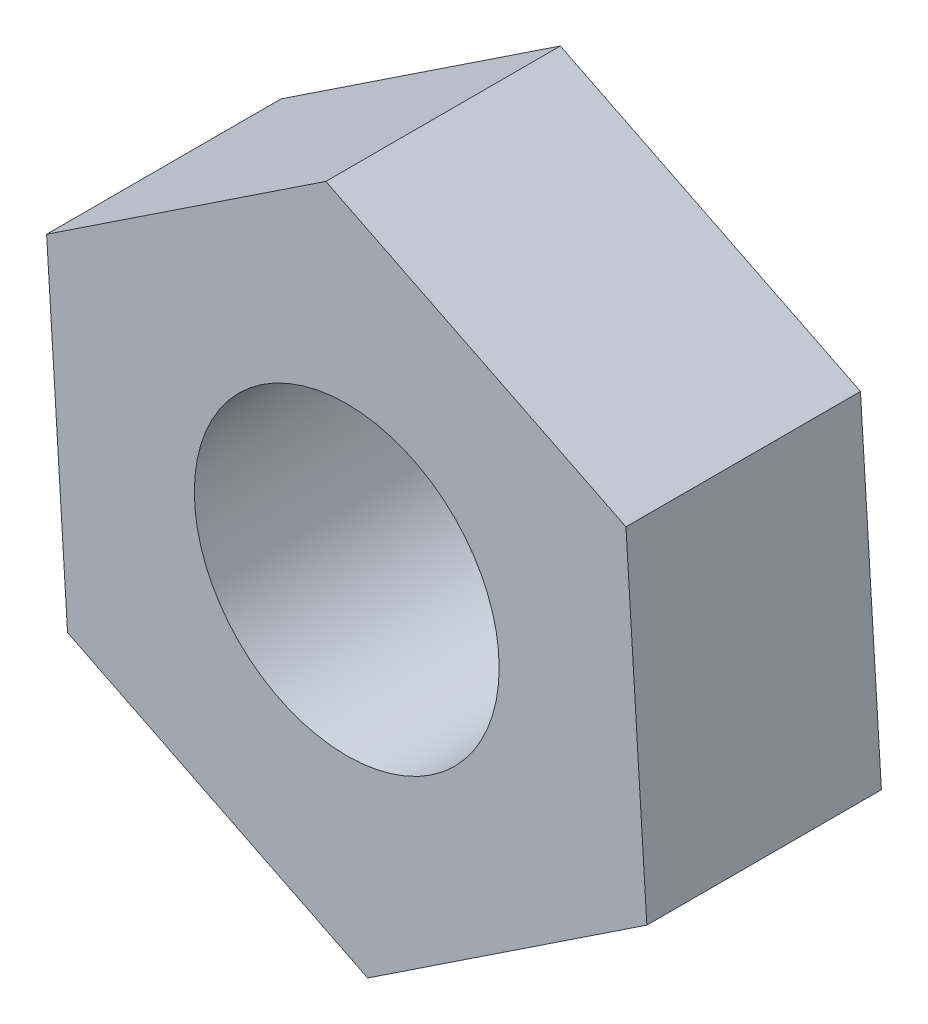
from build123d import *

# Parameters (mm, degrees)
BOSS_EXTRUDE1_DEPTH = 2
SKETCH2_R           = 1.3
CUT_EXTRUDE1_DEPTH  = 5.322766903


with BuildPart() as part:
    # Sketch1 → Boss-Extrude1 (new body)
    with BuildSketch(Plane.XY):
        Polygon((-2.380901217, -1.580762283), (0.178529686, -2.852302079), (2.559430903, -1.271539796), (2.380901217, 1.580762283), (-0.178529686, 2.852302079), (-2.559430903, 1.271539796), align=None)
    extrude(amount=BOSS_EXTRUDE1_DEPTH)

    # Sketch2 → Cut-Extrude1 (cut, through all)
    with BuildSketch(Plane.XY.offset(2)):
        Circle(SKETCH2_R)
    extrude(amount=-CUT_EXTRUDE1_DEPTH, mode=Mode.SUBTRACT)


solid = part.part
